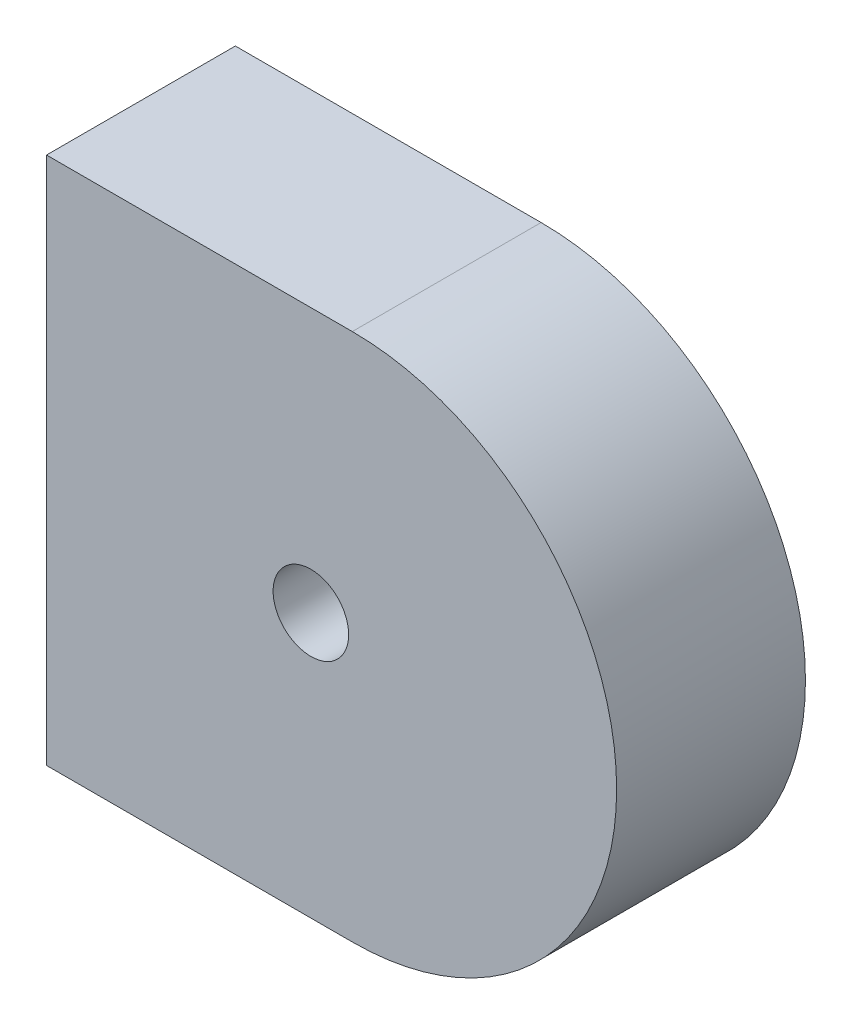
from build123d import *

# Parameters (mm, degrees)
BOSS_EXTRU_1_DEPTH            = 5
TROU_DE_PASSAGE_D_AXE_3_322_D = 2


with BuildPart() as part:
    # Esquisse1 → Boss.-Extru.1 (new body)
    with BuildSketch(Plane.XY):
        with BuildLine():
            Line((0, 14), (0, 0))
            Line((0, 0), (8.096774194, 0))
            ThreePointArc((8.096774194, 0), (15.096774194, 7), (8.096774194, 14))
            Line((8.096774194, 14), (0, 14))
        make_face()
    extrude(amount=BOSS_EXTRU_1_DEPTH)

    # Trou de passage d'axe 3/322 (through all)
    with Locations(Plane(origin=(7, 7, 5), x_dir=(1, 0, 0), z_dir=(0, 0, 1))):
        with Locations((0, 0)):
            Hole(TROU_DE_PASSAGE_D_AXE_3_322_D / 2)


solid = part.part
